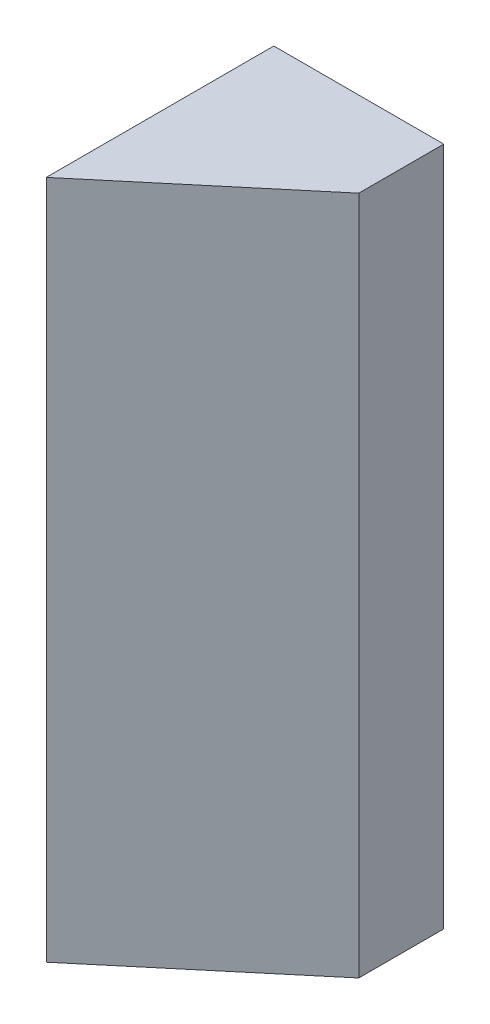
from build123d import *

# Parameters (mm, degrees)
SKETCH1_W           = 6.35
SKETCH1_H           = 25.4
BOSS_EXTRUDE1_DEPTH = 3.175
BOSS_EXTRUDE2_DEPTH = 25.4
SKETCH3_R           = 1.5875
CUT_EXTRUDE1_DEPTH  = 3.175


with BuildPart() as part:
    # Sketch1 → Boss-Extrude1 (new body)
    with BuildSketch(Plane.XY):
        Rectangle(SKETCH1_W, SKETCH1_H)
    extrude(amount=BOSS_EXTRUDE1_DEPTH)

    # Sketch2 → Boss-Extrude2 (add)
    with BuildSketch(Plane(origin=(0, 12.7, 0), x_dir=(1, 0, 0), z_dir=(0, 1, 0))):
        Polygon((-3.175, -3.175), (-3.175, -8.503282658), (3.175, -3.175), align=None)
    extrude(amount=-BOSS_EXTRUDE2_DEPTH)

    # Sketch3 → Cut-Extrude1 (cut)
    with BuildSketch(Plane(origin=(0, 0, 0), x_dir=(-1, 0, 0), z_dir=(0, 0, -1))):
        with Locations((0, 4.233333333)):
            Circle(SKETCH3_R)
        with Locations((0, -4.233333333)):
            Circle(SKETCH3_R)
    extrude(amount=-CUT_EXTRUDE1_DEPTH, mode=Mode.SUBTRACT)


solid = part.part
